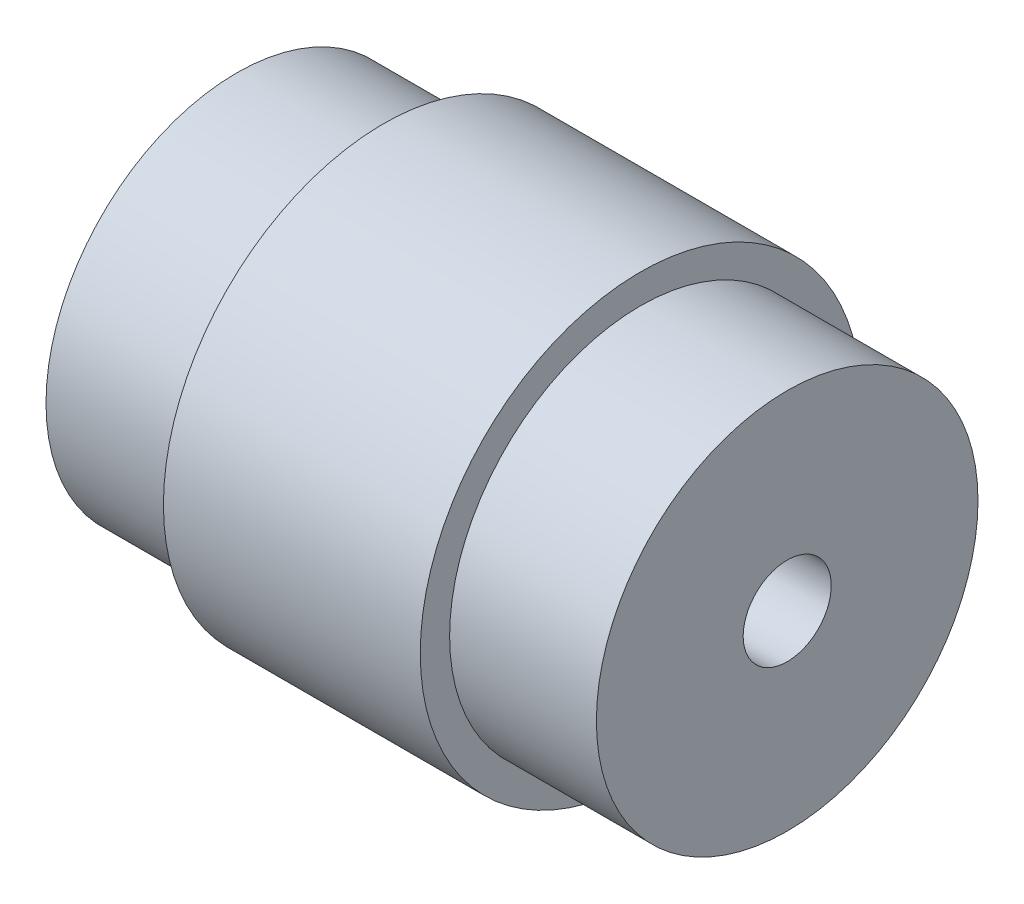
from build123d import *


with BuildPart() as part:
    # Sketch1 → Revolve1 (revolve)
    with BuildSketch(Plane.XY, mode=Mode.PRIVATE) as revolve1_sk:
        Polygon((0, 3), (0, 13), (10, 13), (10, 15), (27.5, 15), (27.5, 13), (37.5, 13), (37.5, 3), align=None)
    revolve(revolve1_sk.sketch.rotate(Axis((0, 0, 0), (1, 0, 0)), 90), axis=Axis((0, 0, 0), (1, 0, 0)))


solid = part.part
